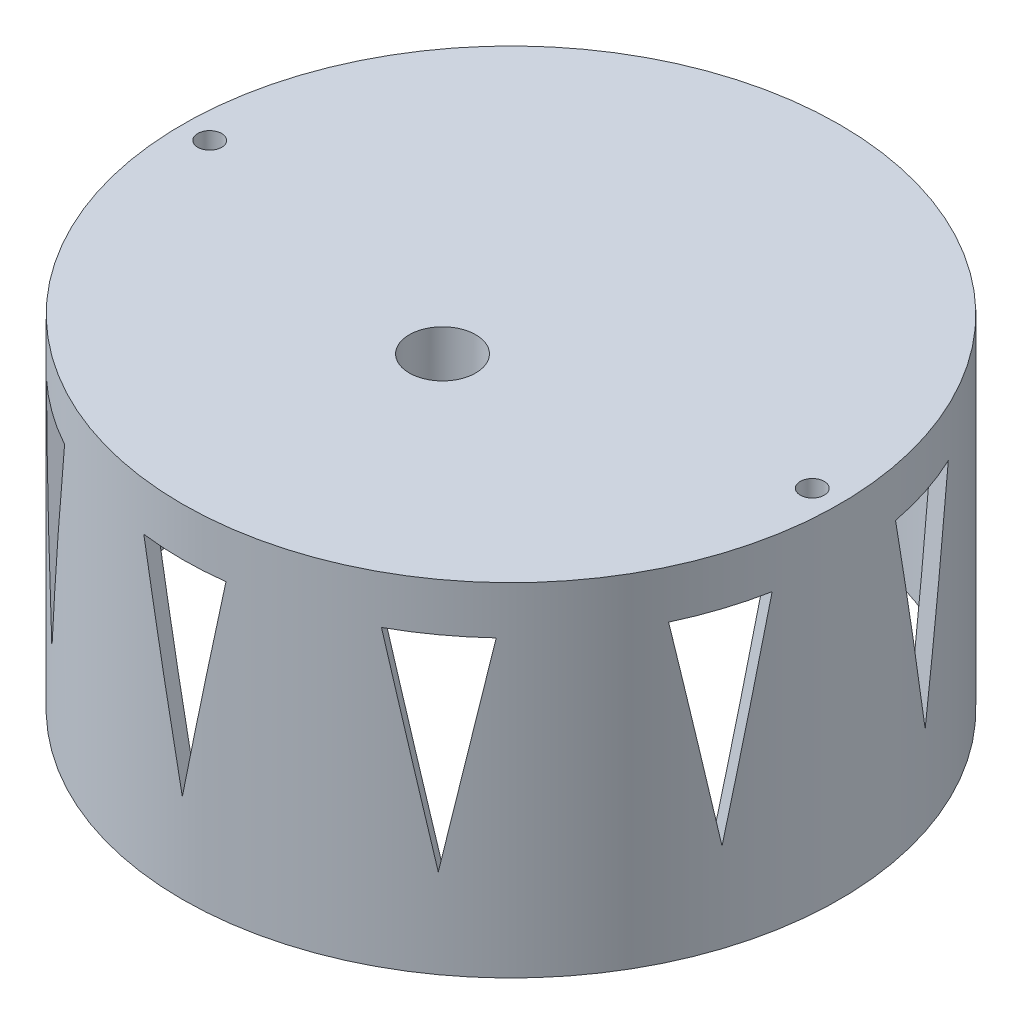
from build123d import *
from build123d.topology import SkipClean

# Parameters (mm, degrees)
SKETCH_3_R                 = 4.85
CUT_EXTRUDE_496_DEPTH      = 38.7
CUT_EXTRUDE_713_DEPTH      = 70.85
PATTERN_CIRCULAR_762_COUNT = 5
SKETCH_5_R                 = 7.5
SKETCH_5_R_2               = 4.85
EXTRUDE_884_DEPTH          = 5
CUT_EXTRUDE_START          = -0.1
CUT_EXTRUDE_1190_DEPTH     = 0.1
FILLET_2_R                 = 2
SKETCH_7_R                 = 1.75
CUT_EXTRUDE_1_DEPTH        = 4


with BuildPart() as part:
    # Эскиз2 → Revolve 372 (revolve)
    with BuildSketch(Plane.XY, mode=Mode.PRIVATE) as revolve_372_sk:
        with BuildLine():
            Line((0, 0), (-48, 0))
            Line((-48, 0), (-48, -50))
            Line((-48, -50), (-46, -50))
            Line((-46, -50), (-46, -5.5))
            ThreePointArc((-46, -5.5), (-45.121320344, -3.378679656), (-43, -2.5))
            Line((-43, -2.5), (0, -2.5))
            Line((0, -2.5), (0, 0))
        make_face()
    revolve(revolve_372_sk.sketch.rotate(Axis((0, 0, 0), (0, 1, 0)), 270), axis=Axis((0, 0, 0), (0, 1, 0)))

    # Эскиз3 → Cut-Extrude 496 (cut)
    with BuildSketch(Plane(origin=(0, 0, 0), x_dir=(1, 0, 0), z_dir=(0, 1, 0))):
        with Locations(Location((0, -10, 0), (0, 0, 270))):
            Circle(SKETCH_3_R)
    extrude(amount=-CUT_EXTRUDE_496_DEPTH, mode=Mode.SUBTRACT)

    # Эскиз4 → Cut-Extrude 713 (cut, symmetric)
    with BuildSketch(Plane.XY):
        Polygon((-6, -7), (6, -7), (0, -37), align=None)
    cut_extrude_713 = extrude(amount=CUT_EXTRUDE_713_DEPTH, both=True, mode=Mode.SUBTRACT)

    # Pattern Circular 762: Cut-Extrude 713 ×5 about axis
    pattern_circular_762_axis = Axis((0, 0, 0), (0, 1, 0))
    for i in range(1, PATTERN_CIRCULAR_762_COUNT):
        add(cut_extrude_713.rotate(pattern_circular_762_axis, i * 360 / PATTERN_CIRCULAR_762_COUNT), mode=Mode.SUBTRACT)

    # Эскиз5 → Extrude 884 (add)
    with BuildSketch(Plane.XZ.offset(2.5)):
        with Locations(Location((0, 10, 0), (0, 0, 90))):
            Circle(SKETCH_5_R)
        with Locations(Location((0, 10, 0), (0, 0, 90))):
            Circle(SKETCH_5_R_2, mode=Mode.SUBTRACT)
    extrude(amount=EXTRUDE_884_DEPTH)

    # Эскиз6 → Cut-Extrude 1190 (cut)
    with SkipClean():  # the faces are left unmerged after this step: merging them gives an invalid solid
        with BuildSketch(Plane.XZ.offset(2.5).offset(CUT_EXTRUDE_START)):
            with BuildLine():
                Line((-0.25, 2.504167825), (-0.25, -34.997321394))
                Line((-0.25, -34.997321394), (0.25, -34.997321394))
                Line((0.25, -34.997321394), (0.25, 2.504167825))
                ThreePointArc((0.25, 2.504167825), (0, 2.5), (-0.25, 2.504167825))
            make_face()
        extrude(amount=CUT_EXTRUDE_1190_DEPTH, mode=Mode.SUBTRACT)

    # Скругление2
    fillet_2_edges = [part.edges().sort_by_distance(p)[0] for p in [
        (0, -7.5, 2.5),
    ]]
    fillet(fillet_2_edges, radius=FILLET_2_R)

    # Эскиз7 → Вырез-Вытянуть1 (cut, symmetric)
    with SkipClean():  # the faces are left unmerged after this step: merging them gives an invalid solid
        with BuildSketch(Plane(origin=(0, 0, 0), x_dir=(1, 0, 0), z_dir=(0, 1, 0))):
            with Locations(Location((44, 0, 0), (0, 0, 234.209624239))):
                Circle(SKETCH_7_R)
            with Locations(Location((-44, 0, 0), (0, 0, 305.790375763))):
                Circle(SKETCH_7_R)
        extrude(amount=CUT_EXTRUDE_1_DEPTH, both=True, mode=Mode.SUBTRACT)


solid = part.part
